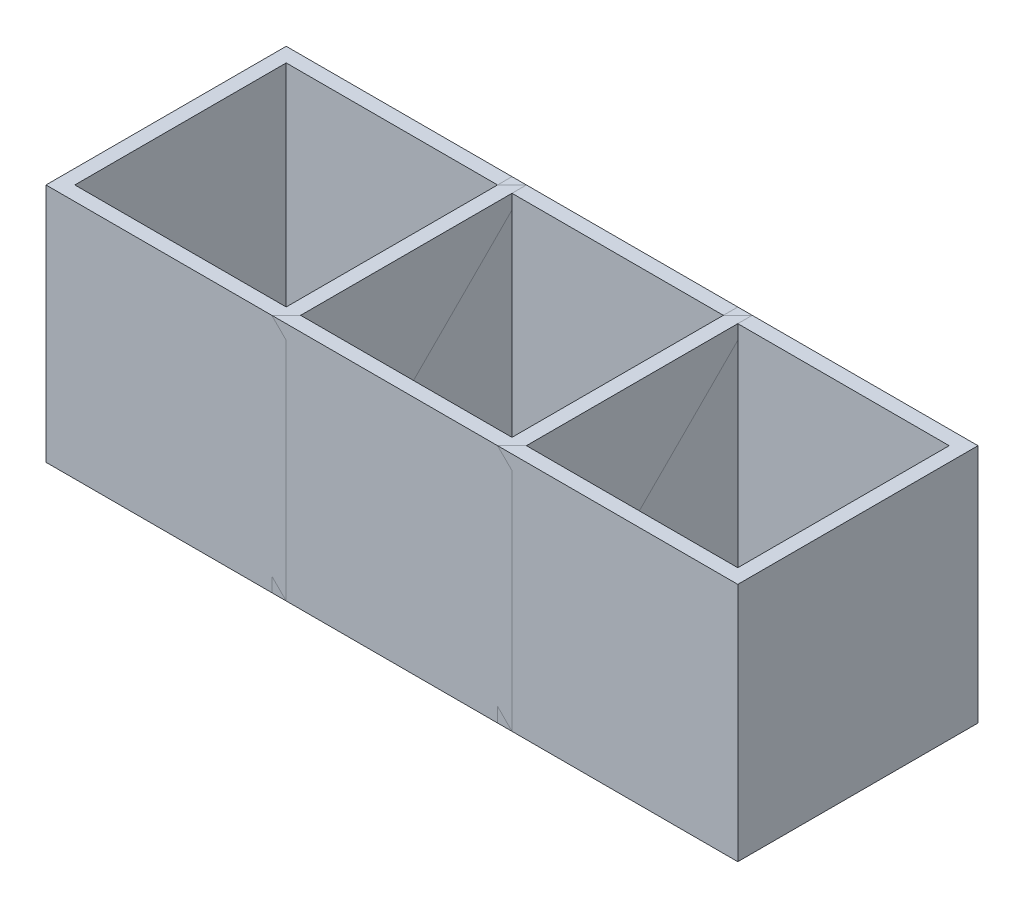
from build123d import *

# Parameters (mm, degrees)
SKETCH_2_W             = 50
SKETCH_2_H             = 50
EXTRUDE_1_DEPTH        = 50
SHELL_1_T              = -3
PATTERN_LINEAR_1_COUNT = 3
PATTERN_LINEAR_1_PITCH = 47


with BuildPart() as part:
    # 草圖2 → 填料-伸長1 (new body)
    with BuildSketch(Plane(origin=(0, 0, 0), x_dir=(1, 0, 0), z_dir=(0, 1, 0))):
        Rectangle(SKETCH_2_W, SKETCH_2_H)
    extrude(amount=EXTRUDE_1_DEPTH)

    # 薄殼1
    shell_1_openings = [part.faces().sort_by_distance(p)[0] for p in [
        (0, 50, 0),
    ]]
    offset(amount=SHELL_1_T, openings=shell_1_openings, kind=Kind.INTERSECTION)


with BuildPart() as pattern_linear_1_1:
    # 直線複製排列1: pattern copy
    add(part.part.moved(Location(Vector(1, 0, 0) * (1 * PATTERN_LINEAR_1_PITCH))))


with BuildPart() as pattern_linear_1_2:
    # 直線複製排列1: pattern copy
    add(part.part.moved(Location(Vector(1, 0, 0) * (2 * PATTERN_LINEAR_1_PITCH))))


solid = Compound([part.part, pattern_linear_1_1.part, pattern_linear_1_2.part])
